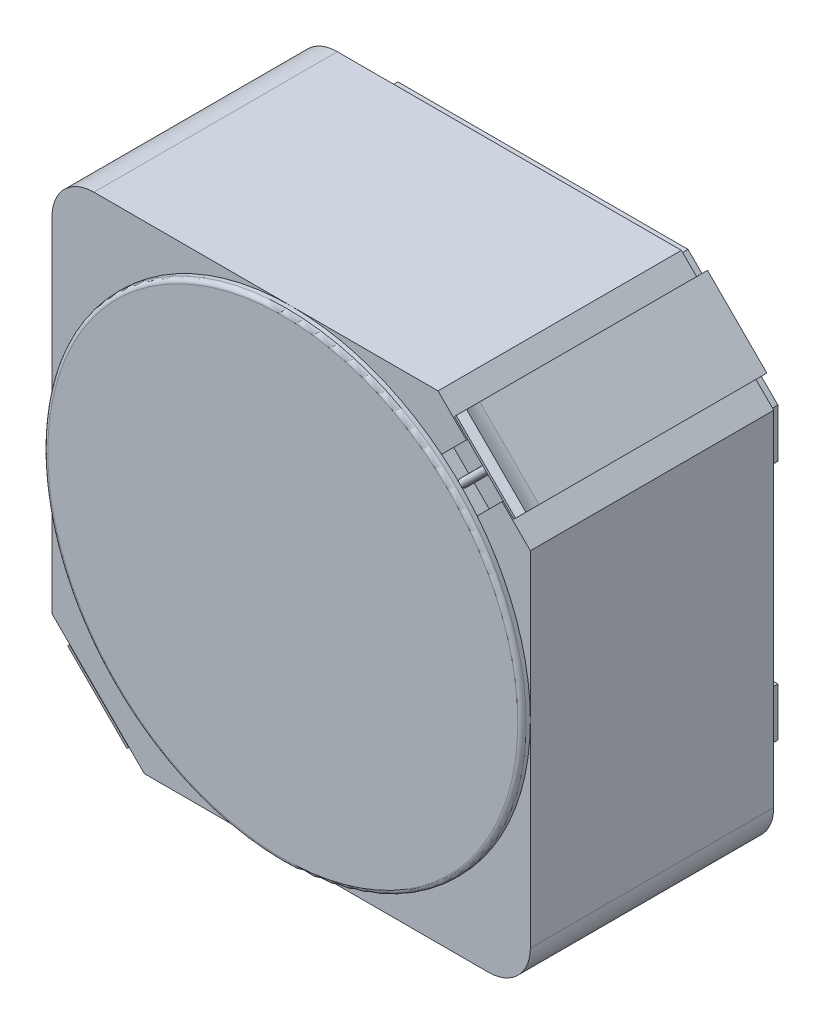
from build123d import *

# Parameters (mm, degrees)
EXTRUDE_START                      = 0.1
EXTRUDE_726_DEPTH                  = 2.9
EXTRUDE_1021_DEPTH                 = 0.1
EXTRUDE_1021_DEPTH_BACK            = 1
SKETCH_2_R                         = 2.85
FILLET_1_R                         = 0.05
EXTRUDE_START_2                    = -0.3
EXTRUDE_1608_DEPTH                 = 1
CUT_EXTRUDE_8_DEPTH                = 0.2
EXTRUDE_START_3                    = 0.05
SKETCH_9_R                         = 0.046
EXTRUDE_1_DEPTH                    = 0.461
EXTRUDE_1_OTHER_WAY_DEPTH          = 0.05
EXTRUDE_1_OTHER_WAY_DRAFT          = 45
PATTERN_CIRCULAR_3_COUNT           = 2
PATTERN_START                      = 0.05
PATTERN_CIRCULAR_3_COPY_1_SKETCH_R = 0.046
PATTERN_CIRCULAR_3_COPY_1_DEPTH    = 0.05
PATTERN_CIRCULAR_3_COPY_1_DRAFT    = 45
PATTERN_CIRCULAR_3_COPY_2_SKETCH_R = 0.046
PATTERN_CIRCULAR_3_COPY_2_DEPTH    = 0.05
PATTERN_CIRCULAR_3_COPY_2_DRAFT    = 45
EXTRUDE_4261_DEPTH                 = 0.1


with BuildPart() as part:
    # Эскиз1 → Extrude 726 (new body)
    with BuildSketch(Plane.XY.offset(EXTRUDE_START)):
        with BuildLine():
            Line((-2.85, -1.75), (-1.75, -2.85))
            Line((-1.75, -2.85), (2.35, -2.85))
            ThreePointArc((2.35, -2.85), (2.703553391, -2.703553391), (2.85, -2.35))
            Line((2.85, -2.35), (2.85, 1.75))
            Line((2.85, 1.75), (1.75, 2.85))
            Line((1.75, 2.85), (-2.35, 2.85))
            ThreePointArc((-2.35, 2.85), (-2.703553391, 2.703553391), (-2.85, 2.35))
            Line((-2.85, 2.35), (-2.85, -1.75))
        make_face()
    extrude(amount=EXTRUDE_726_DEPTH)

    # Эскиз2 → Extrude 1021 (add, two sides: drawn at the far end of the back side and taken through both)
    with BuildSketch(Plane.XY.offset(3).offset(-EXTRUDE_1021_DEPTH_BACK)):
        Circle(SKETCH_2_R)
    extrude(amount=EXTRUDE_1021_DEPTH + EXTRUDE_1021_DEPTH_BACK)

    # Скругление1
    fillet_1_edges = [part.edges().sort_by_distance(p)[0] for p in [
        (-2.85, 0, 3.1),
    ]]
    fillet(fillet_1_edges, radius=FILLET_1_R)

    # Эскиз6 → Extrude 1608 (add)
    with BuildSketch(Plane(origin=(0.55, -0.55, 0), x_dir=(0, 0, 1), z_dir=(0.7071067811865498, -0.7071067811865452, 0)).offset(EXTRUDE_START_2)):
        with BuildLine():
            Line((2.908, -3.347691193), (2.995, -3.295691193))
            Line((2.995, -3.295691193), (2.995, -3.265691193))
            Line((2.995, -3.265691193), (0.125, -3.265691193))
            Line((0.125, -3.265691193), (0.125, -2.765691193))
            Line((0.125, -2.765691193), (0, -2.765691193))
            Line((0, -2.765691193), (0, -3.295691193))
            Line((0, -3.295691193), (2.715, -3.295691193))
            add(Edge.make_bspline(
                [(2.715, -3.295691193), (2.818817166, -3.299465526), (2.908, -3.347691193)],
                knots=[0, 0, 0, 1, 1, 1], degree=2))
        make_face()
    extrude_1608 = extrude(amount=-EXTRUDE_1608_DEPTH)

    # Эскиз8 → Вытянуть8 (cut)
    with BuildSketch(Plane.XY.offset(3)):
        Polygon((2.512132034, 2.087867966), (2.087867966, 2.512132034), (1.735728789, 2.159992857), (2.159992857, 1.735728789), align=None)
        Polygon((-1.687867966, -2.112132034), (-1.342499119, -1.753350263), (-1.774766314, -1.337243218), (-2.12013516, -1.69602499), align=None)
    extrude(amount=-CUT_EXTRUDE_8_DEPTH, mode=Mode.SUBTRACT)

    # Эскиз9 → Бобышка-Вытянуть1 (add)
    with BuildSketch(Plane(origin=(2.309192388, 2.309192388, 0), x_dir=(0, 0, 1), z_dir=(-0.7071067811865452, -0.7071067811865498, 0)).offset(EXTRUDE_START_3)):
        with Locations(Location((2.899, 0, 0), (0, 0, 270))):
            Circle(SKETCH_9_R)
    extrude_1 = extrude(amount=EXTRUDE_1_DEPTH)


with BuildPart() as extrude_1_other_way_tool:
    # Эскиз9 → Бобышка-Вытянуть1 other way (with draft: the straight prism first)
    with BuildSketch(Plane(origin=(2.309192388, 2.309192388, 0), x_dir=(0, 0, 1), z_dir=(-0.7071067811865452, -0.7071067811865498, 0)).offset(EXTRUDE_START_3)):
        with Locations(Location((2.899, 0, 0), (0, 0, 270))):
            Circle(SKETCH_9_R)
    extrude(amount=-EXTRUDE_1_OTHER_WAY_DEPTH)
    # Бобышка-Вытянуть1 other way: the draft: its side faces are tilted about the plane it starts from
    extrude_1_other_way_sides = [extrude_1_other_way_tool.faces().sort_by_distance(p)[0] for p in [
        (2.258987807, 2.324041631, 2.899),
    ]]
    draft(extrude_1_other_way_sides, Plane(origin=(2.309192388, 2.309192388, 0), x_dir=(0, 0, 1), z_dir=(-0.7071067811865452, -0.7071067811865498, 0)).offset(EXTRUDE_START_3), EXTRUDE_1_OTHER_WAY_DRAFT)


with BuildPart() as part_1:
    add(part.part)

    # Бобышка-Вытянуть1 other way: add extrude_1_other_way_tool
    add(extrude_1_other_way_tool.part)

    # Круговой массив3: Extrude 1608, Бобышка-Вытянуть1 ×2 about axis
    pattern_circular_3_axis = Axis((0, 0, 3.1), (0, 0, -1))
    add([extrude_1608.rotate(pattern_circular_3_axis, i * 360 / PATTERN_CIRCULAR_3_COUNT) for i in range(1, PATTERN_CIRCULAR_3_COUNT)])
    add([extrude_1.rotate(pattern_circular_3_axis, i * 360 / PATTERN_CIRCULAR_3_COUNT) for i in range(1, PATTERN_CIRCULAR_3_COUNT)])


with BuildPart() as pattern_circular_3_copy_1_tool:
    # Круговой массив3 copy 1 sketch → Круговой массив3 copy 1 (with draft: the straight prism first)
    with BuildSketch(Plane(origin=(-2.309192388, -2.309192388, 0), x_dir=(0, 0, 1), z_dir=(0.7071067811865451, 0.7071067811865499, 0)).offset(PATTERN_START)):
        with Locations(Location((2.899, 0, 0), (0, 0, 270))):
            Circle(PATTERN_CIRCULAR_3_COPY_1_SKETCH_R)
    extrude(amount=-PATTERN_CIRCULAR_3_COPY_1_DEPTH)
    # Круговой массив3 copy 1: the draft: its side faces are tilted about the plane it starts from
    pattern_circular_3_copy_1_sides = [pattern_circular_3_copy_1_tool.faces().sort_by_distance(p)[0] for p in [
        (-2.258987807, -2.324041631, 2.899),
    ]]
    draft(pattern_circular_3_copy_1_sides, Plane(origin=(-2.309192388, -2.309192388, 0), x_dir=(0, 0, 1), z_dir=(0.7071067811865451, 0.7071067811865499, 0)).offset(PATTERN_START), PATTERN_CIRCULAR_3_COPY_1_DRAFT)


with BuildPart() as part_2:
    add(part_1.part)

    # Круговой массив3 copy 1: add pattern_circular_3_copy_1_tool
    add(pattern_circular_3_copy_1_tool.part)


with BuildPart() as pattern_circular_3_copy_2_tool:
    # Круговой массив3 copy 2 sketch → Круговой массив3 copy 2 (with draft: the straight prism first)
    with BuildSketch(Plane(origin=(-2.309192388, -2.309192388, 0), x_dir=(0, 0, 1), z_dir=(0.7071067811865451, 0.7071067811865499, 0)).offset(PATTERN_START)):
        with Locations(Location((2.899, 0, 0), (0, 0, 270))):
            Circle(PATTERN_CIRCULAR_3_COPY_2_SKETCH_R)
    extrude(amount=-PATTERN_CIRCULAR_3_COPY_2_DEPTH)
    # Круговой массив3 copy 2: the draft: its side faces are tilted about the plane it starts from
    pattern_circular_3_copy_2_sides = [pattern_circular_3_copy_2_tool.faces().sort_by_distance(p)[0] for p in [
        (-2.258987807, -2.324041631, 2.899),
    ]]
    draft(pattern_circular_3_copy_2_sides, Plane(origin=(-2.309192388, -2.309192388, 0), x_dir=(0, 0, 1), z_dir=(0.7071067811865451, 0.7071067811865499, 0)).offset(PATTERN_START), PATTERN_CIRCULAR_3_COPY_2_DRAFT)


with BuildPart() as part_3:
    add(part_2.part)

    # Круговой массив3 copy 2: add pattern_circular_3_copy_2_tool
    add(pattern_circular_3_copy_2_tool.part)

    # Эскиз13 → Extrude 4261 (add)
    with BuildSketch(Plane(origin=(0, 0, 0.1), x_dir=(-1, 0, 0), z_dir=(0, 0, -1))):
        with BuildLine():
            Line((2.050035735, 1.148848765), (2.8, 1.148848765))
            Line((2.8, 1.148848765), (2.8, 1.728848765))
            Line((2.8, 1.728848765), (1.728848765, 2.8))
            Line((1.728848765, 2.8), (-1.728848765, 2.8))
            Line((-1.728848765, 2.8), (-2.8, 1.728848765))
            Line((-2.8, 1.728848765), (-2.8, 1.148848765))
            Line((-2.8, 1.148848765), (-2.050035735, 1.148848765))
            ThreePointArc((-2.050035735, 1.148848765), (0, 2.35), (2.050035735, 1.148848765))
        make_face()
        with BuildLine():
            Line((-2.8, -1.148848765), (-2.050035735, -1.148848765))
            ThreePointArc((-2.050035735, -1.148848765), (0, -2.35), (2.050035735, -1.148848765))
            Line((2.050035735, -1.148848765), (2.8, -1.148848765))
            Line((2.8, -1.148848765), (2.8, -1.728848765))
            Line((2.8, -1.728848765), (1.728848765, -2.8))
            Line((1.728848765, -2.8), (-1.728848765, -2.8))
            Line((-1.728848765, -2.8), (-2.8, -1.728848765))
            Line((-2.8, -1.728848765), (-2.8, -1.148848765))
        make_face()
    extrude(amount=EXTRUDE_4261_DEPTH)


solid = part_3.part
